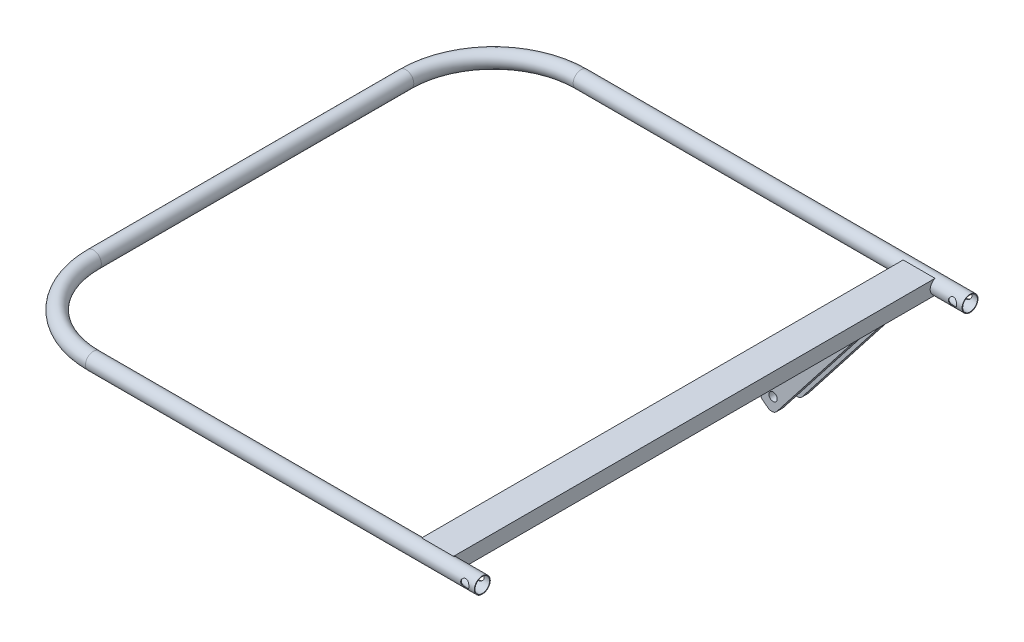
from build123d import *

# Parameters (mm, degrees)
SKETCH2_R           = 12.5
SKETCH2_R_2         = 11.5
SKETCH14_W          = 50
SKETCH14_H          = 23
BOSS_EXTRUDE1_DEPTH = 381.5
SKETCH15_R          = 6.5
CUT_EXTRUDE1_DEPTH  = 436.5
SKETCH16_W          = 40
SKETCH16_H          = 100
BOSS_EXTRUDE2_DEPTH = 5
SKETCH18_R          = 6.5
BOSS_EXTRUDE3_DEPTH = 10


with BuildPart() as part:
    # Sweep-Thin1: sweep along a path in Sketch1
    with BuildLine(Plane(origin=(0, 0, 0), x_dir=(1, 0, 0), z_dir=(0, 1, 0))) as sweep_thin1_path:
        Line((0, 395), (-610, 395))
        ThreePointArc((-610, 395), (-716.066017178, 351.066017178), (-760, 245))
        Line((-760, 245), (-760, -245))
        ThreePointArc((-760, -245), (-716.066017178, -351.066017178), (-610, -395))
        Line((-610, -395), (0, -395))
    # Sketch2 → Sweep-Thin1 (sweep)
    with BuildSketch(Plane(origin=(0, 0, 395), x_dir=(0, 0, -1), z_dir=(1, 0, 0))):
        with Locations((12.5, 0)):
            Circle(SKETCH2_R)
        with Locations((12.5, 0)):
            Circle(SKETCH2_R_2, mode=Mode.SUBTRACT)
    sweep(path=sweep_thin1_path.line)

    # Sketch14 → Boss-Extrude1 (add, symmetric)
    with BuildSketch(Plane.XY):
        with Locations((-75, 0)):
            Rectangle(SKETCH14_W, SKETCH14_H)
    extrude(amount=BOSS_EXTRUDE1_DEPTH, both=True)

    # Sketch15 → Cut-Extrude1 (cut, symmetric)
    with BuildSketch(Plane.XY):
        with Locations((-15, 0)):
            Circle(SKETCH15_R)
    extrude(amount=CUT_EXTRUDE1_DEPTH, both=True, mode=Mode.SUBTRACT)

    # Sketch16 → Boss-Extrude2 (add)
    with BuildSketch(Plane.XZ.offset(11.5)):
        with Locations((-75, -307.601020514)):
            Rectangle(SKETCH16_W, SKETCH16_H)
    extrude(amount=BOSS_EXTRUDE2_DEPTH)

    # Sketch18 → Boss-Extrude3 (add)
    with BuildSketch(Plane(origin=(0, 0, -317.601020514), x_dir=(-1, 0, 0), z_dir=(0, 0, -1))):
        with BuildLine():
            Line((90, -16.5), (60, -16.5))
            Line((60, -16.5), (198.241047903, -193.477674036))
            ThreePointArc((198.241047903, -193.477674036), (204.902077591, -197.247200167), (212.277594342, -195.202598394))
            Line((212.277594342, -195.202598394), (220.426068509, -188.837650874))
            ThreePointArc((220.426068509, -188.837650874), (224.214109013, -182.01512928), (221.946736533, -174.548197259))
            Line((221.946736533, -174.548197259), (90, -16.5))
        make_face()
        with Locations((204.040209344, -176.258653836)):
            Circle(SKETCH18_R, mode=Mode.SUBTRACT)
    boss_extrude3 = extrude(amount=BOSS_EXTRUDE3_DEPTH)

    # Mirror1: Boss-Extrude3 across plane
    add(boss_extrude3.mirror(Plane(origin=(0, 0, -302.601020514), x_dir=(1, 0, 0), z_dir=(0, 0, -1))))


solid = part.part
